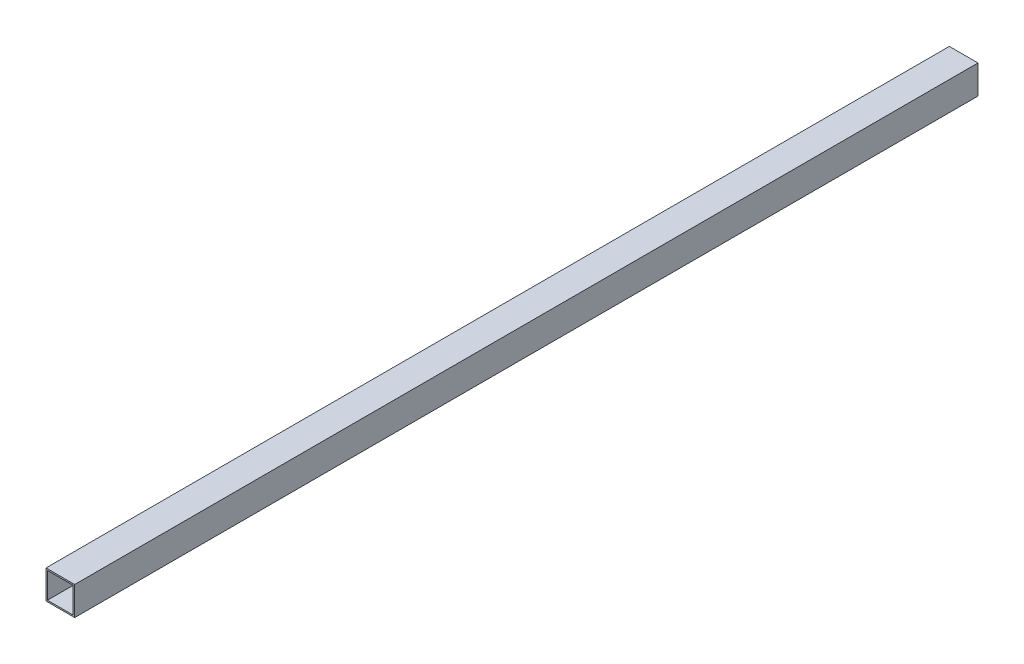
from build123d import *

# Parameters (mm, degrees)
SKETCH1_W           = 31.75
SKETCH1_H           = 31.75
SKETCH1_W_2         = 28.575
SKETCH1_H_2         = 28.575
BOSS_EXTRUDE1_DEPTH = 1000


with BuildPart() as part:
    # Sketch1 → Boss-Extrude1 (new body)
    with BuildSketch(Plane.XY):
        Rectangle(SKETCH1_W, SKETCH1_H)
        Rectangle(SKETCH1_W_2, SKETCH1_H_2, mode=Mode.SUBTRACT)
    extrude(amount=BOSS_EXTRUDE1_DEPTH)


solid = part.part
